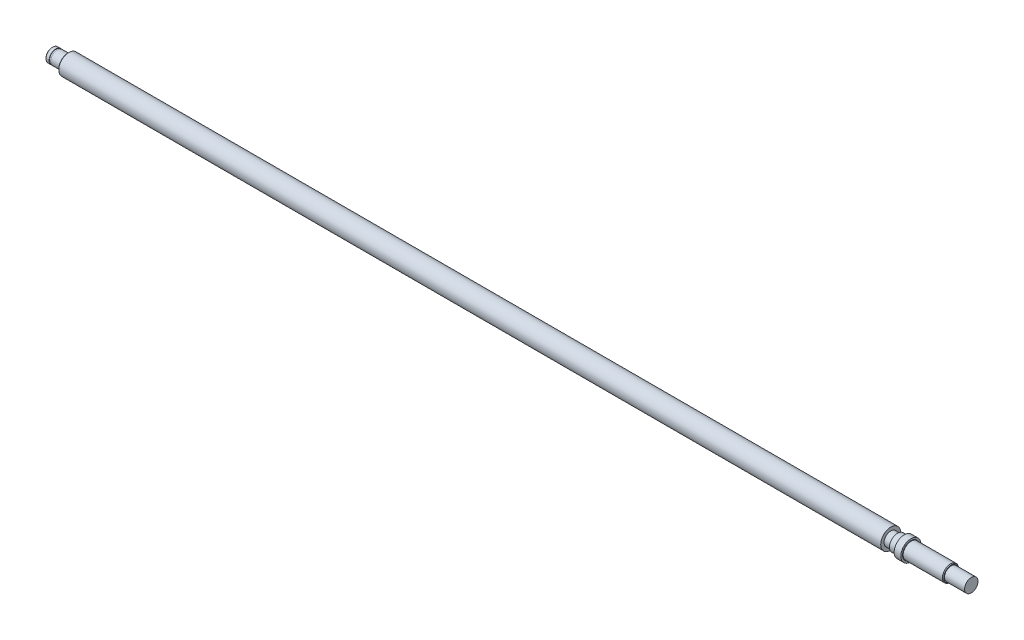
from build123d import *

# Parameters (mm, degrees)
SKETCH_1_W     = 613
SKETCH_1_H     = 7.5
FILLET_1_R     = 0.3
CHAMFER_1_SIZE = 0.5


with BuildPart() as part:
    # 스케치1 → 회전1 (revolve)
    with BuildSketch(Plane.XY, mode=Mode.PRIVATE) as revolve_1_sk:
        with Locations((306.5, 3.75)):
            Rectangle(SKETCH_1_W, SKETCH_1_H)
    revolve(revolve_1_sk.sketch.rotate(Axis((0, 0, 0), (1, 0, 0)), 90), axis=Axis((0, 0, 0), (1, 0, 0)))

    # 스케치2 → 회전3 (revolve)
    with BuildSketch(Plane.XY, mode=Mode.PRIVATE) as revolve_3_sk:
        Polygon((613, 5), (618, 5), (618, 6), (623, 6), (623, 7.5), (628, 7.5), (628, 6.2), (628.2, 6), (657.5, 6), (658, 5.5), (658, 5), (673, 5), (673, 0), (613, 0), align=None)
    revolve(revolve_3_sk.sketch.rotate(Axis((613, 0, 0), (1, 0, 0)), 90), axis=Axis((613, 0, 0), (1, 0, 0)))

    # 스케치3 → 회전4 (revolve)
    with BuildSketch(Plane.XY, mode=Mode.PRIVATE) as revolve_4_sk:
        Polygon((0, 5), (-8, 5), (-8, 4.8), (-9.15, 4.8), (-9.15, 5), (-12, 5), (-12, 0), (0, 0), align=None)
    revolve(revolve_4_sk.sketch.rotate(Axis((0, 0, 0), (-1, 0, 0)), 90), axis=Axis((0, 0, 0), (-1, 0, 0)))

    # 필렛1
    fillet_1_edges = [part.edges().sort_by_distance(p)[0] for p in [
        (0, 0, 5),
    ]]
    fillet(fillet_1_edges, radius=FILLET_1_R)

    # 모따기1
    chamfer_1_edges = [part.edges().sort_by_distance(p)[0] for p in [
        (-12, 0, 5),
        (0, 0, -7.5),
    ]]
    chamfer(chamfer_1_edges, length=CHAMFER_1_SIZE)


solid = part.part
